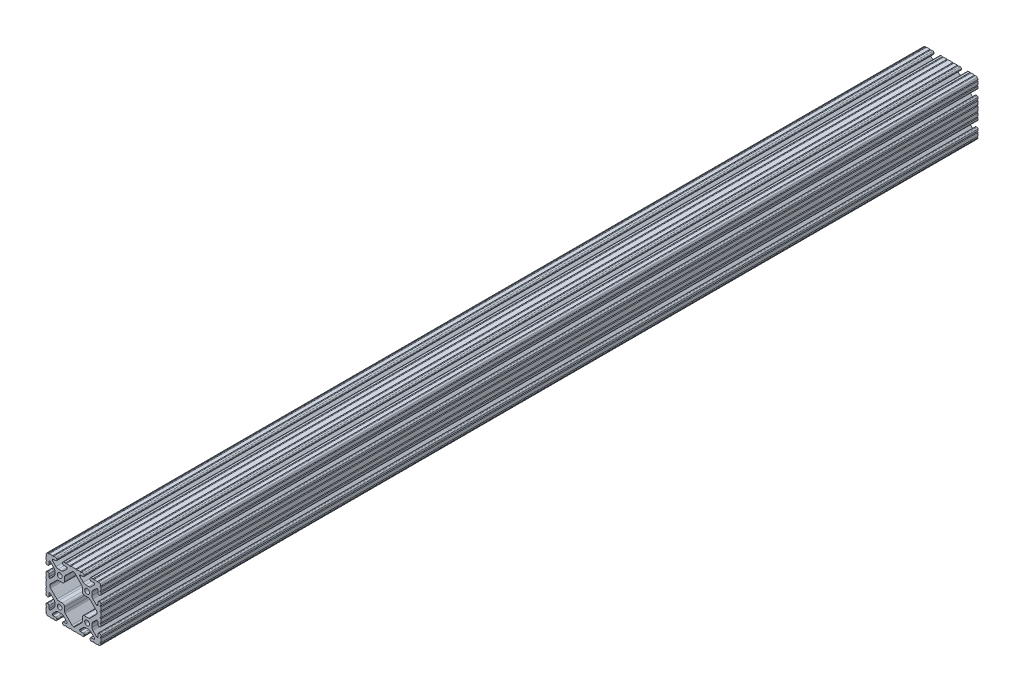
from build123d import *

# Parameters (mm, degrees)
BOSS_EXTRUDE1_DEPTH      = 609.6
BOSS_EXTRUDE1_DEPTH_BACK = 609.6
SKETCH3_R                = 3.3274


with BuildPart() as part:
    # Sketch3 → Boss-Extrude1 (new, two sides: drawn at the far end of the back side and taken through both)
    with BuildSketch(Plane.XY.offset(-BOSS_EXTRUDE1_DEPTH_BACK)):
        with BuildLine():
            Line((34.036, 28.448), (34.036, 24.630196049))
            ThreePointArc((34.036, 24.630196049), (34.497248241, 23.51664429), (35.6108, 23.055396049))
            Line((35.6108, 23.055396049), (36.525200183, 23.055396049))
            ThreePointArc((36.525200183, 23.055396049), (37.638751813, 23.516644236), (38.1, 24.630195866))
            Line((38.1, 24.630195866), (38.1, 27.023826138))
            ThreePointArc((38.1, 27.023826138), (37.117780706, 27.7845421), (38.1, 28.545258062))
            Line((38.1, 28.545258062), (38.1, 33.373016026))
            ThreePointArc((38.1, 33.373016026), (37.141472621, 34.109236774), (38.1, 34.845457521))
            ThreePointArc((38.1, 34.845457521), (37.837757813, 36.120195002), (37.086123144, 37.182631793))
            ThreePointArc((37.086123144, 37.182631793), (36.106286572, 37.843374398), (34.952681874, 38.1))
            ThreePointArc((34.952681874, 38.1), (34.190730434, 37.320215335), (33.428778994, 38.1))
            Line((33.428778994, 38.1), (28.601105935, 38.1))
            ThreePointArc((28.601105935, 38.1), (27.839158581, 37.32021942), (27.077211227, 38.1))
            Line((27.077211227, 38.1), (24.6888, 38.1))
            ThreePointArc((24.6888, 38.1), (23.575248241, 37.638751759), (23.114, 36.5252))
            Line((23.114, 36.5252), (23.114, 35.6108))
            ThreePointArc((23.114, 35.6108), (23.575248241, 34.497248241), (24.6888, 34.036))
            Line((24.6888, 34.036), (28.448, 34.036))
            ThreePointArc((28.448, 34.036), (29.076617928, 33.775617928), (29.337, 33.147))
            Line((29.337, 33.147), (29.337, 32.720693454))
            ThreePointArc((29.337, 32.720693454), (29.326675076, 32.273872751), (29.100231244, 31.888543625))
            Line((29.100231244, 31.888543625), (24.409287499, 27.197588341))
            ThreePointArc((24.409287499, 27.197588341), (22.868340045, 26.167958114), (21.050667579, 25.8064))
            Line((21.050667579, 25.8064), (17.049332421, 25.8064))
            ThreePointArc((17.049332421, 25.8064), (15.231659955, 26.167958114), (13.690712501, 27.197588341))
            Line((13.690712501, 27.197588341), (9.023381298, 31.864931024))
            ThreePointArc((9.023381298, 31.864931024), (8.830670886, 32.153343113), (8.763, 32.493548179))
            Line((8.763, 32.493548179), (8.763, 33.147))
            ThreePointArc((8.763, 33.147), (9.023382072, 33.775617928), (9.652, 34.036))
            Line((9.652, 34.036), (13.4112, 34.036))
            ThreePointArc((13.4112, 34.036), (14.524751759, 34.497248241), (14.986, 35.6108))
            Line((14.986, 35.6108), (14.986, 36.5252))
            ThreePointArc((14.986, 36.5252), (14.524751759, 37.638751759), (13.4112, 38.1))
            Line((13.4112, 38.1), (11.128867074, 38.1))
            ThreePointArc((11.128867074, 38.1), (10.367071033, 37.320370693), (9.605274992, 38.1))
            Line((9.605274992, 38.1), (4.777313069, 38.1))
            ThreePointArc((4.777313069, 38.1), (4.015517029, 37.320370693), (3.253720988, 38.1))
            Line((3.253720988, 38.1), (-3.253720988, 38.1))
            ThreePointArc((-3.253720988, 38.1), (-4.015517029, 37.320370693), (-4.777313069, 38.1))
            Line((-4.777313069, 38.1), (-9.605274992, 38.1))
            ThreePointArc((-9.605274992, 38.1), (-10.367071033, 37.320370693), (-11.128867074, 38.1))
            Line((-11.128867074, 38.1), (-13.4112, 38.1))
            ThreePointArc((-13.4112, 38.1), (-14.524751759, 37.638751759), (-14.986, 36.5252))
            Line((-14.986, 36.5252), (-14.986, 35.6108))
            ThreePointArc((-14.986, 35.6108), (-14.524751759, 34.497248241), (-13.4112, 34.036))
            Line((-13.4112, 34.036), (-9.652, 34.036))
            ThreePointArc((-9.652, 34.036), (-9.023382072, 33.775617928), (-8.763, 33.147))
            Line((-8.763, 33.147), (-8.763, 32.493548179))
            ThreePointArc((-8.763, 32.493548179), (-8.830670886, 32.153343113), (-9.023381298, 31.864931024))
            Line((-9.023381298, 31.864931024), (-13.690712501, 27.197588341))
            ThreePointArc((-13.690712501, 27.197588341), (-15.231659955, 26.167958114), (-17.049332421, 25.8064))
            Line((-17.049332421, 25.8064), (-21.050667579, 25.8064))
            ThreePointArc((-21.050667579, 25.8064), (-22.868340045, 26.167958114), (-24.409287499, 27.197588341))
            Line((-24.409287499, 27.197588341), (-29.100231244, 31.888543625))
            ThreePointArc((-29.100231244, 31.888543625), (-29.326675076, 32.273872751), (-29.337, 32.720693454))
            Line((-29.337, 32.720693454), (-29.337, 33.147))
            ThreePointArc((-29.337, 33.147), (-29.076617928, 33.775617928), (-28.448, 34.036))
            Line((-28.448, 34.036), (-24.6888, 34.036))
            ThreePointArc((-24.6888, 34.036), (-23.575248241, 34.497248241), (-23.114, 35.6108))
            Line((-23.114, 35.6108), (-23.114, 36.5252))
            ThreePointArc((-23.114, 36.5252), (-23.575248241, 37.638751759), (-24.6888, 38.1))
            Line((-24.6888, 38.1), (-27.077211227, 38.1))
            ThreePointArc((-27.077211227, 38.1), (-27.839158581, 37.32021942), (-28.601105935, 38.1))
            Line((-28.601105935, 38.1), (-33.428778994, 38.1))
            ThreePointArc((-33.428778994, 38.1), (-34.190730434, 37.320215335), (-34.952681874, 38.1))
            ThreePointArc((-34.952681874, 38.1), (-36.106286572, 37.843374398), (-37.086123144, 37.182631793))
            ThreePointArc((-37.086123144, 37.182631793), (-37.837757813, 36.120195002), (-38.1, 34.845457521))
            ThreePointArc((-38.1, 34.845457521), (-37.141472621, 34.109236774), (-38.1, 33.373016026))
            Line((-38.1, 33.373016026), (-38.1, 28.545258062))
            ThreePointArc((-38.1, 28.545258062), (-37.117780706, 27.7845421), (-38.1, 27.023826138))
            Line((-38.1, 27.023826138), (-38.1, 24.630195866))
            ThreePointArc((-38.1, 24.630195866), (-37.638751813, 23.516644236), (-36.525200183, 23.055396049))
            Line((-36.525200183, 23.055396049), (-35.6108, 23.055396049))
            ThreePointArc((-35.6108, 23.055396049), (-34.497248241, 23.51664429), (-34.036, 24.630196049))
            Line((-34.036, 24.630196049), (-34.036, 28.448))
            ThreePointArc((-34.036, 28.448), (-33.775617928, 29.076617928), (-33.147, 29.337))
            Line((-33.147, 29.337), (-32.664287242, 29.337))
            ThreePointArc((-32.664287242, 29.337), (-32.324081166, 29.269328695), (-32.03566854, 29.076617155))
            Line((-32.03566854, 29.076617155), (-27.19758008, 24.238516795))
            ThreePointArc((-27.19758008, 24.238516795), (-26.167955879, 22.697572205), (-25.8064, 20.879905136))
            Line((-25.8064, 20.879905136), (-25.8064, 17.220094864))
            ThreePointArc((-25.8064, 17.220094864), (-26.167955879, 15.402427795), (-27.19758008, 13.861483205))
            Line((-27.19758008, 13.861483205), (-31.948944541, 9.110107057))
            ThreePointArc((-31.948944541, 9.110107057), (-32.333417096, 8.853210196), (-32.786933649, 8.763))
            Line((-32.786933649, 8.763), (-33.060275787, 8.763))
            ThreePointArc((-33.060275787, 8.763), (-33.750216995, 9.048783005), (-34.036, 9.738724213))
            Line((-34.036, 9.738724213), (-34.036, 13.469803585))
            ThreePointArc((-34.036, 13.469803585), (-34.497248348, 14.583355603), (-35.610800366, 15.044603951))
            Line((-35.610800366, 15.044603951), (-36.5252, 15.044603951))
            ThreePointArc((-36.5252, 15.044603951), (-37.638751759, 14.58335571), (-38.1, 13.469803951))
            Line((-38.1, 13.469803951), (-38.1, 11.075039289))
            ThreePointArc((-38.1, 11.075039289), (-37.117000248, 10.313517272), (-38.1, 9.551995255))
            Line((-38.1, 9.551995255), (-38.1, 4.723759308))
            ThreePointArc((-38.1, 4.723759308), (-37.117000248, 3.962237292), (-38.1, 3.200715275))
            Line((-38.1, 3.200715275), (-38.1, -3.200715275))
            ThreePointArc((-38.1, -3.200715275), (-37.117000248, -3.962237292), (-38.1, -4.723759308))
            Line((-38.1, -4.723759308), (-38.1, -9.551995255))
            ThreePointArc((-38.1, -9.551995255), (-37.117000248, -10.313517272), (-38.1, -11.075039289))
            Line((-38.1, -11.075039289), (-38.1, -13.469803951))
            ThreePointArc((-38.1, -13.469803951), (-37.638751759, -14.58335571), (-36.5252, -15.044603951))
            Line((-36.5252, -15.044603951), (-35.610800366, -15.044603951))
            ThreePointArc((-35.610800366, -15.044603951), (-34.497248348, -14.583355603), (-34.036, -13.469803585))
            Line((-34.036, -13.469803585), (-34.036, -9.738724213))
            ThreePointArc((-34.036, -9.738724213), (-33.750216995, -9.048783005), (-33.060275787, -8.763))
            Line((-33.060275787, -8.763), (-32.786933649, -8.763))
            ThreePointArc((-32.786933649, -8.763), (-32.333417096, -8.853210196), (-31.948944541, -9.110107057))
            Line((-31.948944541, -9.110107057), (-27.19758008, -13.861483205))
            ThreePointArc((-27.19758008, -13.861483205), (-26.167955879, -15.402427795), (-25.8064, -17.220094864))
            Line((-25.8064, -17.220094864), (-25.8064, -20.879905136))
            ThreePointArc((-25.8064, -20.879905136), (-26.167955879, -22.697572205), (-27.19758008, -24.238516795))
            Line((-27.19758008, -24.238516795), (-32.03566854, -29.076617155))
            ThreePointArc((-32.03566854, -29.076617155), (-32.324081166, -29.269328695), (-32.664287242, -29.337))
            Line((-32.664287242, -29.337), (-33.147, -29.337))
            ThreePointArc((-33.147, -29.337), (-33.775617928, -29.076617928), (-34.036, -28.448))
            Line((-34.036, -28.448), (-34.036, -24.630196049))
            ThreePointArc((-34.036, -24.630196049), (-34.497248241, -23.51664429), (-35.6108, -23.055396049))
            Line((-35.6108, -23.055396049), (-36.525200183, -23.055396049))
            ThreePointArc((-36.525200183, -23.055396049), (-37.638751813, -23.516644236), (-38.1, -24.630195866))
            Line((-38.1, -24.630195866), (-38.1, -27.023826138))
            ThreePointArc((-38.1, -27.023826138), (-37.117780706, -27.7845421), (-38.1, -28.545258062))
            Line((-38.1, -28.545258062), (-38.1, -33.373016026))
            ThreePointArc((-38.1, -33.373016026), (-37.141472621, -34.109236774), (-38.1, -34.845457521))
            ThreePointArc((-38.1, -34.845457521), (-37.837757813, -36.120195002), (-37.086123144, -37.182631793))
            ThreePointArc((-37.086123144, -37.182631793), (-36.106286572, -37.843374398), (-34.952681874, -38.1))
            ThreePointArc((-34.952681874, -38.1), (-34.190730434, -37.320215335), (-33.428778994, -38.1))
            Line((-33.428778994, -38.1), (-28.601105935, -38.1))
            ThreePointArc((-28.601105935, -38.1), (-27.839158581, -37.32021942), (-27.077211227, -38.1))
            Line((-27.077211227, -38.1), (-24.6888, -38.1))
            ThreePointArc((-24.6888, -38.1), (-23.575248241, -37.638751759), (-23.114, -36.5252))
            Line((-23.114, -36.5252), (-23.114, -35.6108))
            ThreePointArc((-23.114, -35.6108), (-23.575248241, -34.497248241), (-24.6888, -34.036))
            Line((-24.6888, -34.036), (-28.448, -34.036))
            ThreePointArc((-28.448, -34.036), (-29.076617928, -33.775617928), (-29.337, -33.147))
            Line((-29.337, -33.147), (-29.337, -32.720693454))
            ThreePointArc((-29.337, -32.720693454), (-29.326675076, -32.273872751), (-29.100231244, -31.888543625))
            Line((-29.100231244, -31.888543625), (-24.409287499, -27.197588341))
            ThreePointArc((-24.409287499, -27.197588341), (-22.868340045, -26.167958114), (-21.050667579, -25.8064))
            Line((-21.050667579, -25.8064), (-17.049332421, -25.8064))
            ThreePointArc((-17.049332421, -25.8064), (-15.231659955, -26.167958114), (-13.690712501, -27.197588341))
            Line((-13.690712501, -27.197588341), (-9.023381298, -31.864931024))
            ThreePointArc((-9.023381298, -31.864931024), (-8.830670886, -32.153343113), (-8.763, -32.493548179))
            Line((-8.763, -32.493548179), (-8.763, -33.147))
            ThreePointArc((-8.763, -33.147), (-9.023382072, -33.775617928), (-9.652, -34.036))
            Line((-9.652, -34.036), (-13.4112, -34.036))
            ThreePointArc((-13.4112, -34.036), (-14.524751759, -34.497248241), (-14.986, -35.6108))
            Line((-14.986, -35.6108), (-14.986, -36.5252))
            ThreePointArc((-14.986, -36.5252), (-14.524751759, -37.638751759), (-13.4112, -38.1))
            Line((-13.4112, -38.1), (-11.128867074, -38.1))
            ThreePointArc((-11.128867074, -38.1), (-10.367071033, -37.320370693), (-9.605274992, -38.1))
            Line((-9.605274992, -38.1), (-4.777313069, -38.1))
            ThreePointArc((-4.777313069, -38.1), (-4.015517029, -37.320370693), (-3.253720988, -38.1))
            Line((-3.253720988, -38.1), (3.253720988, -38.1))
            ThreePointArc((3.253720988, -38.1), (4.015517029, -37.320370693), (4.777313069, -38.1))
            Line((4.777313069, -38.1), (9.605274992, -38.1))
            ThreePointArc((9.605274992, -38.1), (10.367071033, -37.320370693), (11.128867074, -38.1))
            Line((11.128867074, -38.1), (13.4112, -38.1))
            ThreePointArc((13.4112, -38.1), (14.524751759, -37.638751759), (14.986, -36.5252))
            Line((14.986, -36.5252), (14.986, -35.6108))
            ThreePointArc((14.986, -35.6108), (14.524751759, -34.497248241), (13.4112, -34.036))
            Line((13.4112, -34.036), (9.652, -34.036))
            ThreePointArc((9.652, -34.036), (9.023382072, -33.775617928), (8.763, -33.147))
            Line((8.763, -33.147), (8.763, -32.493548179))
            ThreePointArc((8.763, -32.493548179), (8.830670886, -32.153343113), (9.023381298, -31.864931024))
            Line((9.023381298, -31.864931024), (13.690712501, -27.197588341))
            ThreePointArc((13.690712501, -27.197588341), (15.231659955, -26.167958114), (17.049332421, -25.8064))
            Line((17.049332421, -25.8064), (21.050667579, -25.8064))
            ThreePointArc((21.050667579, -25.8064), (22.868340045, -26.167958114), (24.409287499, -27.197588341))
            Line((24.409287499, -27.197588341), (29.100231244, -31.888543625))
            ThreePointArc((29.100231244, -31.888543625), (29.326675076, -32.273872751), (29.337, -32.720693454))
            Line((29.337, -32.720693454), (29.337, -33.147))
            ThreePointArc((29.337, -33.147), (29.076617928, -33.775617928), (28.448, -34.036))
            Line((28.448, -34.036), (24.6888, -34.036))
            ThreePointArc((24.6888, -34.036), (23.575248241, -34.497248241), (23.114, -35.6108))
            Line((23.114, -35.6108), (23.114, -36.5252))
            ThreePointArc((23.114, -36.5252), (23.575248241, -37.638751759), (24.6888, -38.1))
            Line((24.6888, -38.1), (27.077211227, -38.1))
            ThreePointArc((27.077211227, -38.1), (27.839158581, -37.32021942), (28.601105935, -38.1))
            Line((28.601105935, -38.1), (33.428778994, -38.1))
            ThreePointArc((33.428778994, -38.1), (34.190730434, -37.320215335), (34.952681874, -38.1))
            ThreePointArc((34.952681874, -38.1), (36.106286572, -37.843374398), (37.086123144, -37.182631793))
            ThreePointArc((37.086123144, -37.182631793), (37.837757813, -36.120195002), (38.1, -34.845457521))
            ThreePointArc((38.1, -34.845457521), (37.141472621, -34.109236774), (38.1, -33.373016026))
            Line((38.1, -33.373016026), (38.1, -28.545258062))
            ThreePointArc((38.1, -28.545258062), (37.117780706, -27.7845421), (38.1, -27.023826138))
            Line((38.1, -27.023826138), (38.1, -24.630195866))
            ThreePointArc((38.1, -24.630195866), (37.638751813, -23.516644236), (36.525200183, -23.055396049))
            Line((36.525200183, -23.055396049), (35.6108, -23.055396049))
            ThreePointArc((35.6108, -23.055396049), (34.497248241, -23.51664429), (34.036, -24.630196049))
            Line((34.036, -24.630196049), (34.036, -28.448))
            ThreePointArc((34.036, -28.448), (33.775617928, -29.076617928), (33.147, -29.337))
            Line((33.147, -29.337), (32.664287242, -29.337))
            ThreePointArc((32.664287242, -29.337), (32.324081166, -29.269328695), (32.03566854, -29.076617155))
            Line((32.03566854, -29.076617155), (27.19758008, -24.238516795))
            ThreePointArc((27.19758008, -24.238516795), (26.167955879, -22.697572205), (25.8064, -20.879905136))
            Line((25.8064, -20.879905136), (25.8064, -17.220094864))
            ThreePointArc((25.8064, -17.220094864), (26.167955879, -15.402427795), (27.19758008, -13.861483205))
            Line((27.19758008, -13.861483205), (31.948944541, -9.110107057))
            ThreePointArc((31.948944541, -9.110107057), (32.333417096, -8.853210196), (32.786933649, -8.763))
            Line((32.786933649, -8.763), (33.060275787, -8.763))
            ThreePointArc((33.060275787, -8.763), (33.750216995, -9.048783005), (34.036, -9.738724213))
            Line((34.036, -9.738724213), (34.036, -13.469803585))
            ThreePointArc((34.036, -13.469803585), (34.497248348, -14.583355603), (35.610800366, -15.044603951))
            Line((35.610800366, -15.044603951), (36.5252, -15.044603951))
            ThreePointArc((36.5252, -15.044603951), (37.638751759, -14.58335571), (38.1, -13.469803951))
            Line((38.1, -13.469803951), (38.1, -11.075039289))
            ThreePointArc((38.1, -11.075039289), (37.117000248, -10.313517272), (38.1, -9.551995255))
            Line((38.1, -9.551995255), (38.1, -4.723759308))
            ThreePointArc((38.1, -4.723759308), (37.117000248, -3.962237292), (38.1, -3.200715275))
            Line((38.1, -3.200715275), (38.1, 3.200715275))
            ThreePointArc((38.1, 3.200715275), (37.117000248, 3.962237292), (38.1, 4.723759308))
            Line((38.1, 4.723759308), (38.1, 9.551995255))
            ThreePointArc((38.1, 9.551995255), (37.117000248, 10.313517272), (38.1, 11.075039289))
            Line((38.1, 11.075039289), (38.1, 13.469803951))
            ThreePointArc((38.1, 13.469803951), (37.638751759, 14.58335571), (36.5252, 15.044603951))
            Line((36.5252, 15.044603951), (35.610800366, 15.044603951))
            ThreePointArc((35.610800366, 15.044603951), (34.497248348, 14.583355603), (34.036, 13.469803585))
            Line((34.036, 13.469803585), (34.036, 9.738724213))
            ThreePointArc((34.036, 9.738724213), (33.750216995, 9.048783005), (33.060275787, 8.763))
            Line((33.060275787, 8.763), (32.786933649, 8.763))
            ThreePointArc((32.786933649, 8.763), (32.333417096, 8.853210196), (31.948944541, 9.110107057))
            Line((31.948944541, 9.110107057), (27.19758008, 13.861483205))
            ThreePointArc((27.19758008, 13.861483205), (26.167955879, 15.402427795), (25.8064, 17.220094864))
            Line((25.8064, 17.220094864), (25.8064, 20.879905136))
            ThreePointArc((25.8064, 20.879905136), (26.167955879, 22.697572205), (27.19758008, 24.238516795))
            Line((27.19758008, 24.238516795), (32.03566854, 29.076617155))
            ThreePointArc((32.03566854, 29.076617155), (32.324081166, 29.269328695), (32.664287242, 29.337))
            Line((32.664287242, 29.337), (33.147, 29.337))
            ThreePointArc((33.147, 29.337), (33.775617928, 29.076617928), (34.036, 28.448))
        make_face()
        with Locations(Location((19.05, 19.05, 0), (0, 0, 180))):
            Circle(SKETCH3_R, mode=Mode.SUBTRACT)
        with Locations(Location((-19.05, 19.05, 0), (0, 0, 180))):
            Circle(SKETCH3_R, mode=Mode.SUBTRACT)
        with Locations(Location((19.05, -19.05, 0), (0, 0, 180))):
            Circle(SKETCH3_R, mode=Mode.SUBTRACT)
        with Locations(Location((-19.05, -19.05, 0), (0, 0, 180))):
            Circle(SKETCH3_R, mode=Mode.SUBTRACT)
        with BuildLine():
            Line((-11.363666791, -22.843321003), (-2.051515952, -32.155494748))
            ThreePointArc((-2.051515952, -32.155494748), (-1.11031328, -32.786013752), (0, -33.011005091))
            ThreePointArc((0, -33.011005091), (1.11031328, -32.786013752), (2.051515952, -32.155494748))
            Line((2.051515952, -32.155494748), (11.363666791, -22.843321003))
            ThreePointArc((11.363666791, -22.843321003), (12.051918263, -21.813277828), (12.2936, -20.598259734))
            Line((12.2936, -20.598259734), (12.2936, -15.4686))
            ThreePointArc((12.2936, -15.4686), (13.22353597, -13.22353597), (15.4686, -12.2936))
            Line((15.4686, -12.2936), (20.769026744, -12.2936))
            ThreePointArc((20.769026744, -12.2936), (21.984048446, -12.051916769), (23.014093535, -11.363661269))
            Line((23.014093535, -11.363661269), (31.902125566, -2.475607377))
            ThreePointArc((31.902125566, -2.475607377), (32.607298578, -1.335259481), (32.728725173, 0))
            ThreePointArc((32.728725173, 0), (32.607298578, 1.335259481), (31.902125566, 2.475607377))
            Line((31.902125566, 2.475607377), (23.014093535, 11.363661269))
            ThreePointArc((23.014093535, 11.363661269), (21.984048446, 12.051916769), (20.769026744, 12.2936))
            Line((20.769026744, 12.2936), (15.4686, 12.2936))
            ThreePointArc((15.4686, 12.2936), (13.22353597, 13.22353597), (12.2936, 15.4686))
            Line((12.2936, 15.4686), (12.2936, 20.598259734))
            ThreePointArc((12.2936, 20.598259734), (12.051918263, 21.813277828), (11.363666791, 22.843321003))
            Line((11.363666791, 22.843321003), (2.051515952, 32.155494748))
            ThreePointArc((2.051515952, 32.155494748), (1.11031328, 32.786013752), (0, 33.011005091))
            ThreePointArc((0, 33.011005091), (-1.11031328, 32.786013752), (-2.051515952, 32.155494748))
            Line((-2.051515952, 32.155494748), (-11.363666791, 22.843321003))
            ThreePointArc((-11.363666791, 22.843321003), (-12.051918263, 21.813277828), (-12.2936, 20.598259734))
            Line((-12.2936, 20.598259734), (-12.2936, 15.4686))
            ThreePointArc((-12.2936, 15.4686), (-13.22353597, 13.22353597), (-15.4686, 12.2936))
            Line((-15.4686, 12.2936), (-20.769026744, 12.2936))
            ThreePointArc((-20.769026744, 12.2936), (-21.984048446, 12.051916769), (-23.014093535, 11.363661269))
            Line((-23.014093535, 11.363661269), (-31.902125566, 2.475607377))
            ThreePointArc((-31.902125566, 2.475607377), (-32.607298578, 1.335259481), (-32.728725173, 0))
            ThreePointArc((-32.728725173, 0), (-32.607298578, -1.335259481), (-31.902125566, -2.475607377))
            Line((-31.902125566, -2.475607377), (-23.014093535, -11.363661269))
            ThreePointArc((-23.014093535, -11.363661269), (-21.984048446, -12.051916769), (-20.769026744, -12.2936))
            Line((-20.769026744, -12.2936), (-15.4686, -12.2936))
            ThreePointArc((-15.4686, -12.2936), (-13.22353597, -13.22353597), (-12.2936, -15.4686))
            Line((-12.2936, -15.4686), (-12.2936, -20.598259734))
            ThreePointArc((-12.2936, -20.598259734), (-12.051918263, -21.813277828), (-11.363666791, -22.843321003))
        make_face(mode=Mode.SUBTRACT)
    extrude(amount=BOSS_EXTRUDE1_DEPTH + BOSS_EXTRUDE1_DEPTH_BACK)


solid = part.part
